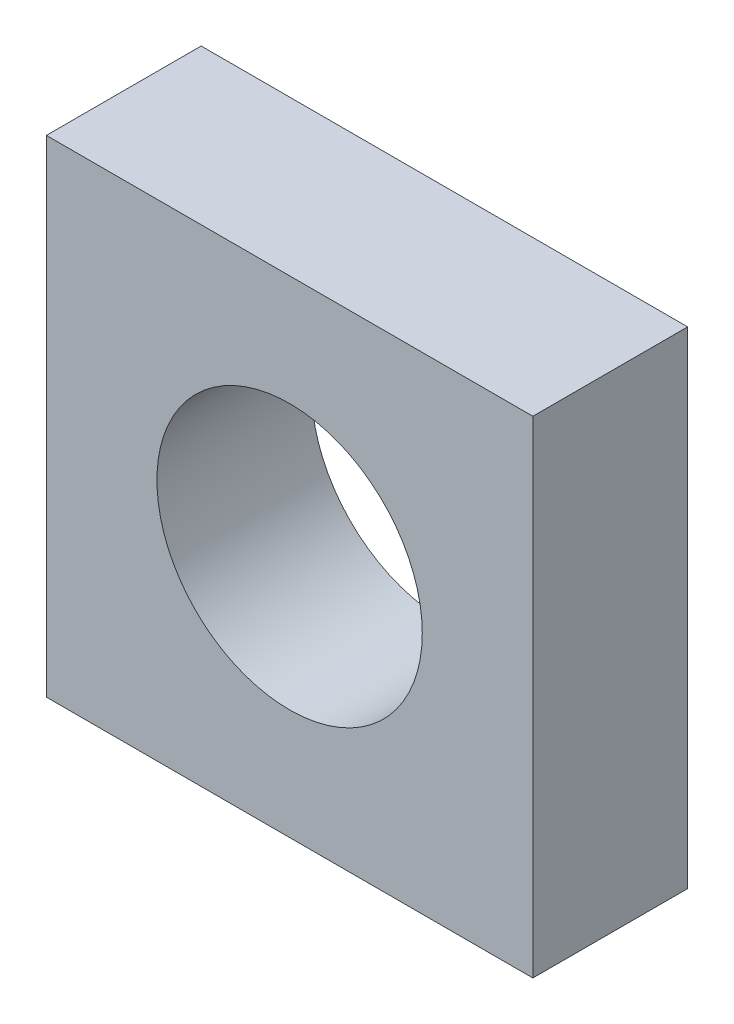
from build123d import *

# Parameters (mm, degrees)
SKETCH1_W           = 5.5
SKETCH1_H           = 5.5
SKETCH1_R           = 1.5
BOSS_EXTRUDE1_DEPTH = 1.75


with BuildPart() as part:
    # Sketch1 → Boss-Extrude1 (new body)
    with BuildSketch(Plane.XY):
        with Locations((2.75, 2.75)):
            Rectangle(SKETCH1_W, SKETCH1_H)
        with Locations((2.75, 2.75)):
            Circle(SKETCH1_R, mode=Mode.SUBTRACT)
    extrude(amount=BOSS_EXTRUDE1_DEPTH)


solid = part.part
